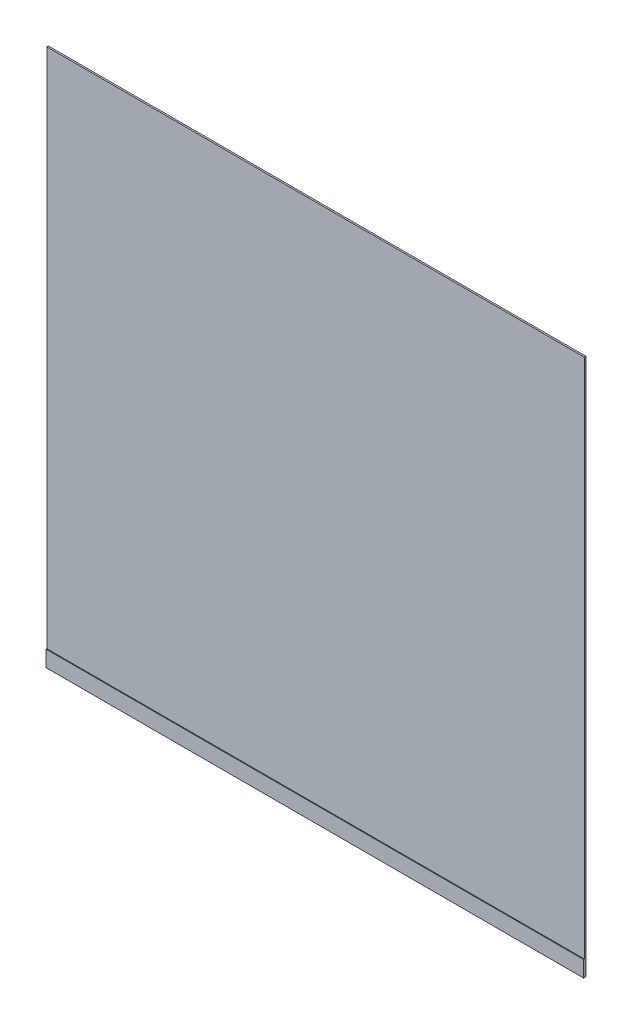
from build123d import *

# Parameters (mm, degrees)
SKETCH1_W           = 3500
SKETCH1_H           = 3500
BOSS_EXTRUDE1_DEPTH = 10
SKETCH2_W           = 3500
SKETCH2_H           = 104.737095793
BOSS_EXTRUDE2_DEPTH = 5


with BuildPart() as part:
    # Sketch1 → Boss-Extrude1 (new body)
    with BuildSketch(Plane.XY):
        Rectangle(SKETCH1_W, SKETCH1_H)
    extrude(amount=BOSS_EXTRUDE1_DEPTH)

    # Sketch2 → Boss-Extrude2 (add)
    with BuildSketch(Plane.XY.offset(10)):
        with Locations((0, -1697.631452104)):
            Rectangle(SKETCH2_W, SKETCH2_H)
    extrude(amount=BOSS_EXTRUDE2_DEPTH)


solid = part.part
